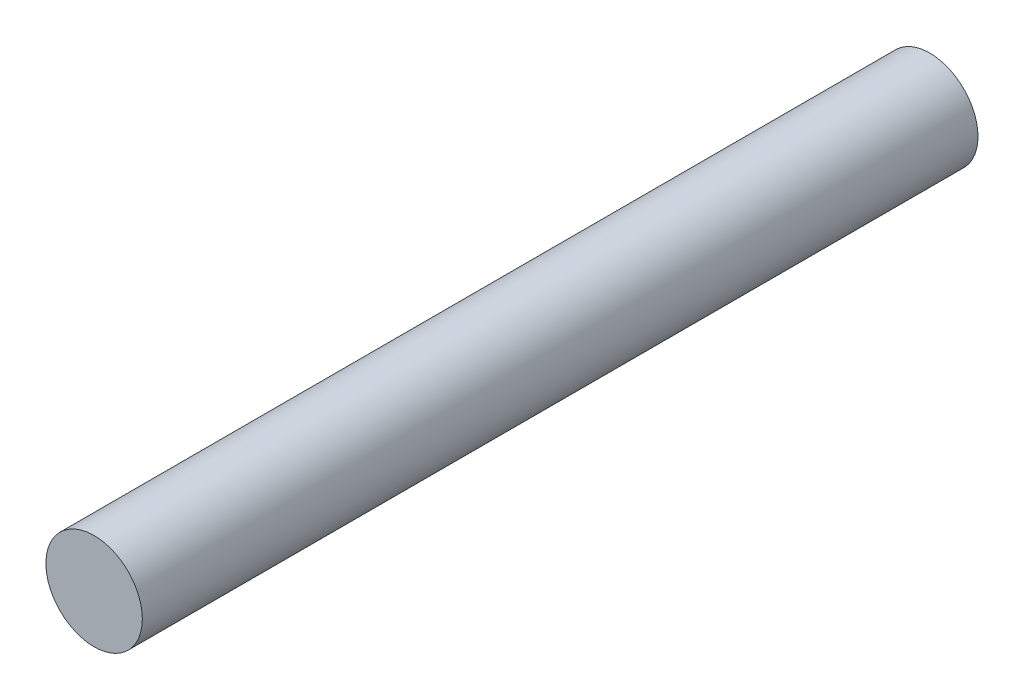
from build123d import *

# Parameters (mm, degrees)
SKETCH_1_R      = 7.5
EXTRUDE_1_DEPTH = 130


with BuildPart() as part:
    # 草图1 → 凸台-拉伸1 (new body)
    with BuildSketch(Plane.XY):
        Circle(SKETCH_1_R)
    extrude(amount=EXTRUDE_1_DEPTH)


solid = part.part
